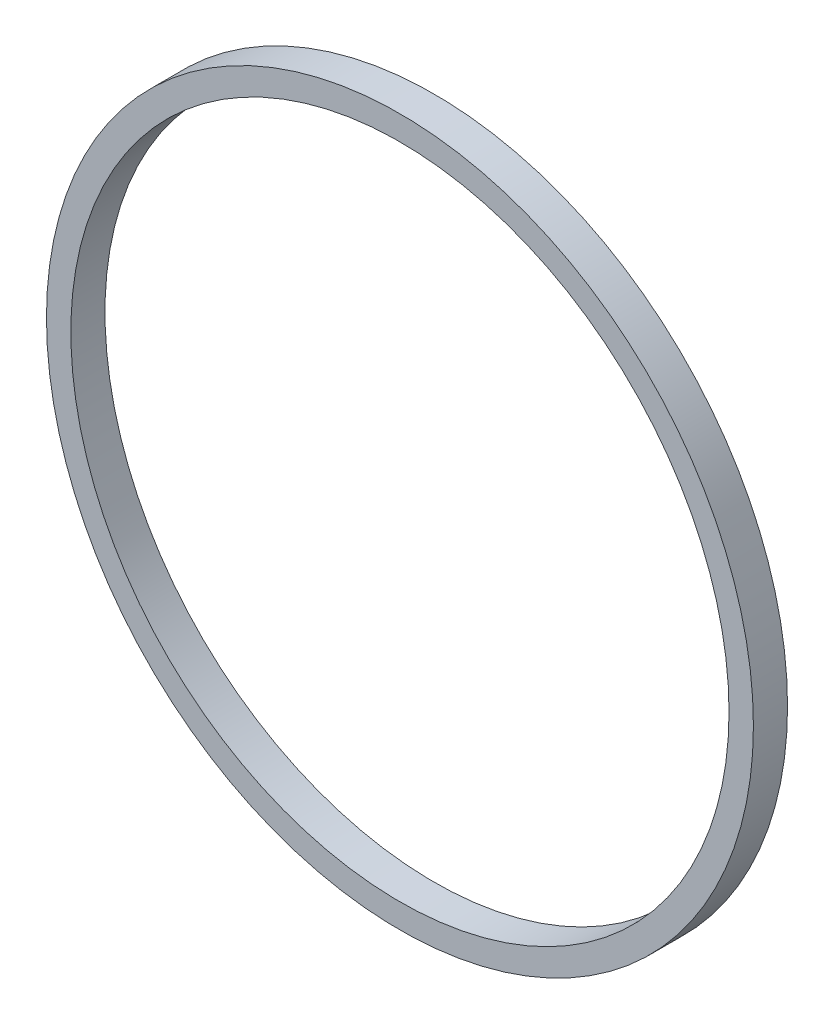
from build123d import *

# Parameters (mm, degrees)
SKETCH_1_R      = 14.5
SKETCH_1_R_2    = 13.5
EXTRUDE_1_DEPTH = 1.4


with BuildPart() as part:
    # 草图1 → 凸台-拉伸1 (new body)
    with BuildSketch(Plane.XY):
        Circle(SKETCH_1_R)
        Circle(SKETCH_1_R_2, mode=Mode.SUBTRACT)
    extrude(amount=EXTRUDE_1_DEPTH)


solid = part.part
